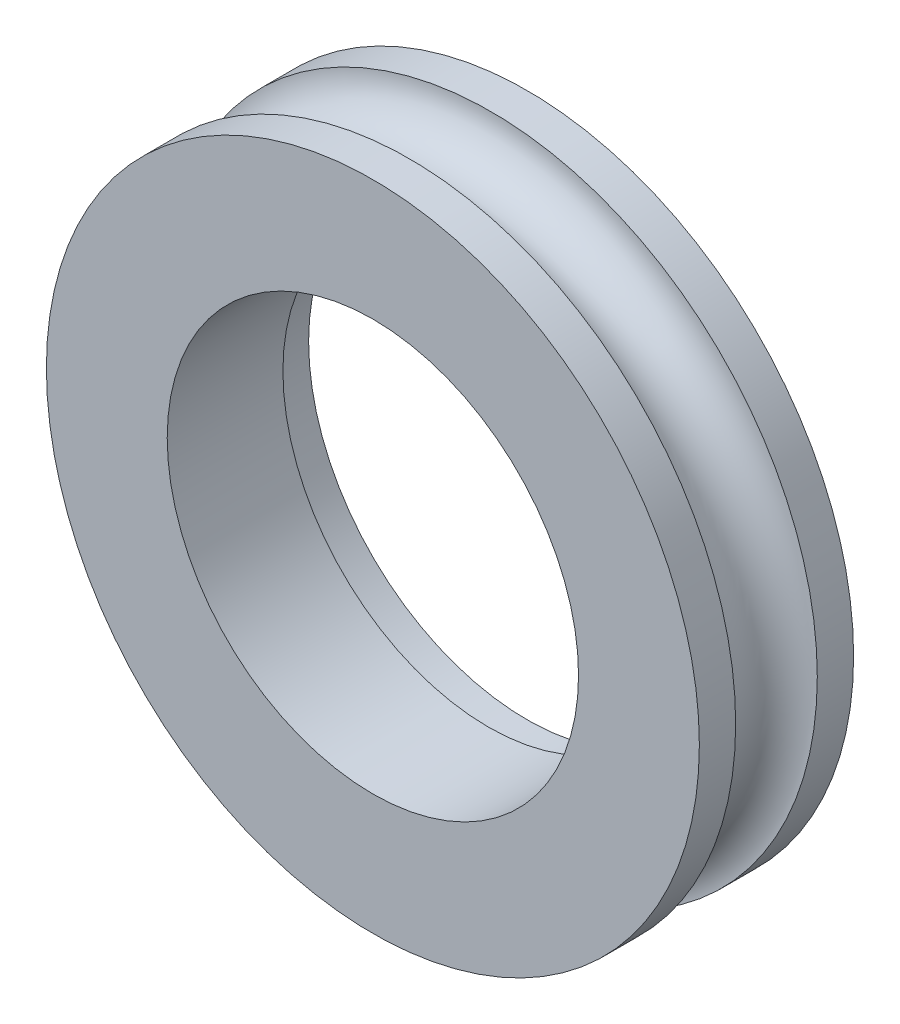
from build123d import *

# Parameters (mm, degrees)
SKETCH2_R          = 17
CUT_EXTRUDE1_DEPTH = 3


with BuildPart() as part:
    # Sketch1 → Revolve1 (revolve)
    with BuildSketch(Plane(origin=(0, 0, 0), x_dir=(1, 0, 0), z_dir=(0, 1, 0))):
        with BuildLine():
            Line((16, 0), (25.4, 0))
            Line((25.4, 0), (25.4, 2.825))
            ThreePointArc((25.4, 2.825), (22.225, 6), (25.4, 9.175))
            Line((25.4, 9.175), (25.4, 12))
            Line((25.4, 12), (16, 12))
            Line((16, 12), (16, 0))
        make_face()
    revolve(axis=Axis((0, 0, 0), (0, 0, -1)))

    # Sketch2 → Cut-Extrude1 (cut)
    with BuildSketch(Plane(origin=(0, 0, -12), x_dir=(-1, 0, 0), z_dir=(0, 0, -1))):
        Circle(SKETCH2_R)
    extrude(amount=-CUT_EXTRUDE1_DEPTH, mode=Mode.SUBTRACT)


solid = part.part
